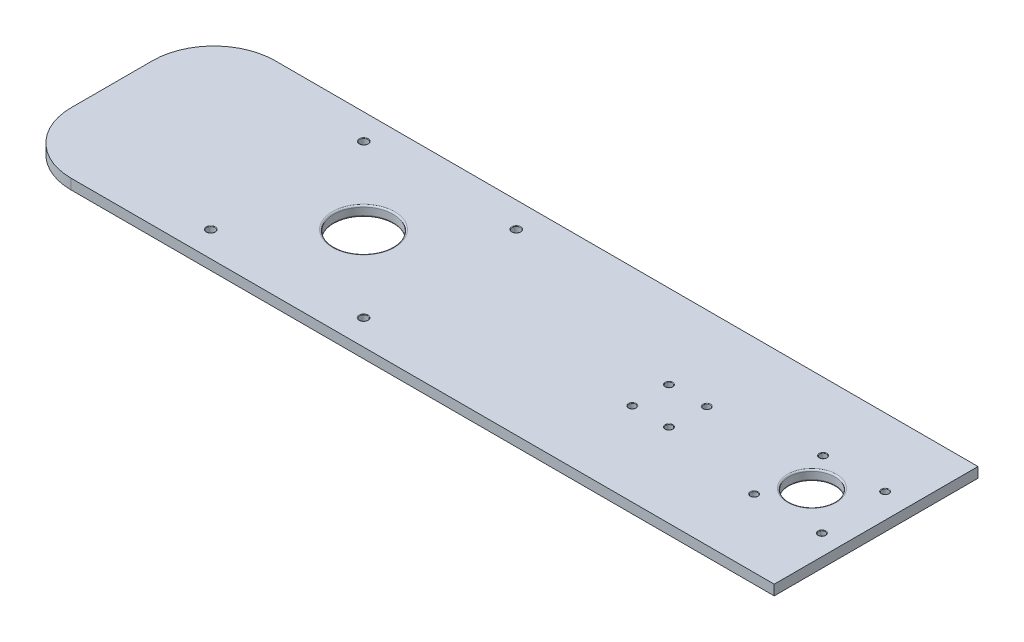
from build123d import *

# Parameters (mm, degrees)
SKETCH3_W           = 750
SKETCH3_H           = 200
BOSS_EXTRUDE1_DEPTH = 10
SKETCH6_R           = 29
SKETCH6_R_2         = 3.4
SKETCH6_R_3         = 22.5
SKETCH6_R_4         = 4
CUT_EXTRUDE1_DEPTH  = 20
FILLET6_R           = 60
FILLET7_R           = 0.5
FILLET8_R           = 1.5


with BuildPart() as part:
    # Sketch3 → Boss-Extrude1 (new body)
    with BuildSketch(Plane(origin=(0, 0, 0), x_dir=(1, 0, 0), z_dir=(0, 1, 0))):
        Rectangle(SKETCH3_W, SKETCH3_H)
    extrude(amount=BOSS_EXTRUDE1_DEPTH)

    # Sketch6 → Cut-Extrude1 (cut)
    with BuildSketch(Plane(origin=(0, 10, 0), x_dir=(1, 0, 0), z_dir=(0, 1, 0))):
        with Locations(Location((-127.99996593, -0.09339148, 0), (0, 0, 270))):
            Circle(SKETCH6_R)
        with Locations(Location((153.696568915, -18, 0), (0, 0, 270))):
            Circle(SKETCH6_R_2)
        with Locations(Location((153.696568915, 18, 0), (0, 0, 270))):
            Circle(SKETCH6_R_2)
        with Locations(Location((190.867618998, 17.980948316, 0), (0, 0, 270))):
            Circle(SKETCH6_R_2)
        with Locations(Location((189.696568915, -18, 0), (0, 0, 270))):
            Circle(SKETCH6_R_2)
        with Locations(Location((288.53, -33.23, 0), (0, 0, 270))):
            Circle(SKETCH6_R_2)
        with Locations(Location((289.696568915, 33.24, 0), (0, 0, 270))):
            Circle(SKETCH6_R_2)
        with Locations(Location((350.619163081, 33.24, 0), (0, 0, 270))):
            Circle(SKETCH6_R_2)
        with Locations(Location((355, -33.23, 0), (0, 0, 270))):
            Circle(SKETCH6_R_2)
        with Locations(Location((312, 0, 0), (0, 0, 270))):
            Circle(SKETCH6_R_3)
        with Locations(Location((-52.99996593, -75, 0), (0, 0, 270))):
            Circle(SKETCH6_R_4)
        with Locations(Location((-202.99996593, -75, 0), (0, 0, 270))):
            Circle(SKETCH6_R_4)
        with Locations(Location((-202.812949803, 75, 0), (0, 0, 270))):
            Circle(SKETCH6_R_4)
        with Locations(Location((-53.186982056, 75, 0), (0, 0, 270))):
            Circle(SKETCH6_R_4)
    extrude(amount=-CUT_EXTRUDE1_DEPTH, mode=Mode.SUBTRACT)

    # Fillet6
    fillet6_edges = [part.edges().sort_by_distance(p)[0] for p in [
        (-375, 5, 100),
        (-375, 5, -100),
    ]]
    fillet(fillet6_edges, radius=FILLET6_R)

    # Fillet7
    fillet7_edges = [part.edges().sort_by_distance(p)[0] for p in [
        (153.696568915, 0, -21.4),
        (153.696568915, 10, -21.4),
        (153.696568915, 0, 14.6),
        (153.696568915, 10, 14.6),
        (190.867618998, 0, -21.380948316),
        (190.867618998, 10, -21.380948316),
        (189.696568915, 0, 14.6),
        (189.696568915, 10, 14.6),
        (288.53, 0, 29.83),
        (288.53, 10, 29.83),
        (289.696568915, 0, -36.64),
        (289.696568915, 10, -36.64),
        (350.619163081, 0, -36.64),
        (350.619163081, 10, -36.64),
        (355, 0, 29.83),
        (355, 10, 29.83),
        (-53.186982056, 0, -79),
        (-53.186982056, 10, -79),
        (-202.812949803, 0, -79),
        (-202.812949803, 10, -79),
        (-202.99996593, 0, 71),
        (-202.99996593, 10, 71),
        (-52.99996593, 0, 71),
        (-52.99996593, 10, 71),
    ]]
    fillet(fillet7_edges, radius=FILLET7_R)

    # Fillet8
    fillet8_edges = [part.edges().sort_by_distance(p)[0] for p in [
        (312, 0, -22.5),
        (312, 10, -22.5),
        (-127.99996593, 0, -28.90660852),
        (-127.99996593, 10, -28.90660852),
    ]]
    fillet(fillet8_edges, radius=FILLET8_R)


solid = part.part
